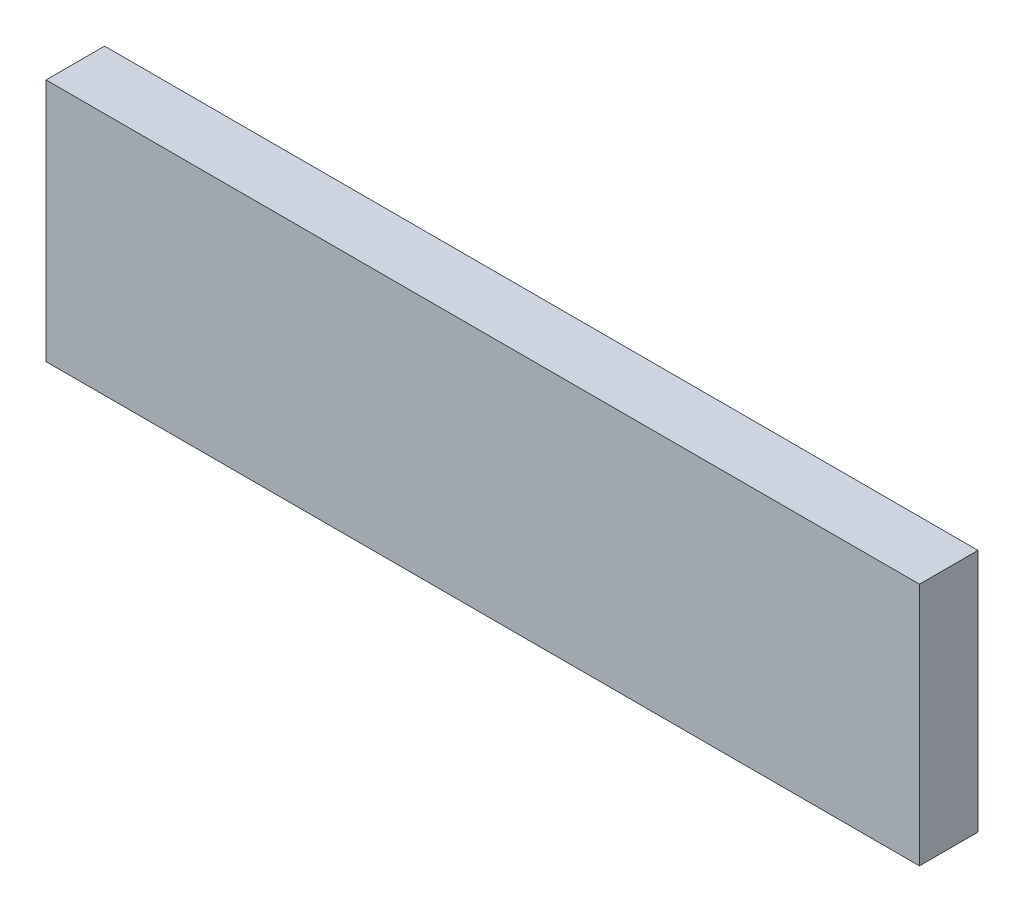
from build123d import *

# Parameters (mm, degrees)
ESBO_O1_W                = 179
ESBO_O1_H                = 50
RESSALTO_EXTRUS_O1_DEPTH = 6
ESBO_O2_R                = 3
CORTE_EXTRUS_O1_DEPTH    = 20


with BuildPart() as part:
    # Esboço1 → Ressalto-extrusão1 (new, symmetric)
    with BuildSketch(Plane.XY):
        Rectangle(ESBO_O1_W, ESBO_O1_H)
    extrude(amount=RESSALTO_EXTRUS_O1_DEPTH, both=True)

    # Esboço2 → Corte-extrusão1 (cut)
    with BuildSketch(Plane(origin=(0, -25, 0), x_dir=(-1, 0, 0), z_dir=(0, -1, 0))):
        with Locations(Location((81, 0, 0), (0, 0, 90))):
            Circle(ESBO_O2_R)
        with Locations(Location((-69, 0, 0), (0, 0, 90))):
            Circle(ESBO_O2_R)
    extrude(amount=-CORTE_EXTRUS_O1_DEPTH, mode=Mode.SUBTRACT)


solid = part.part
